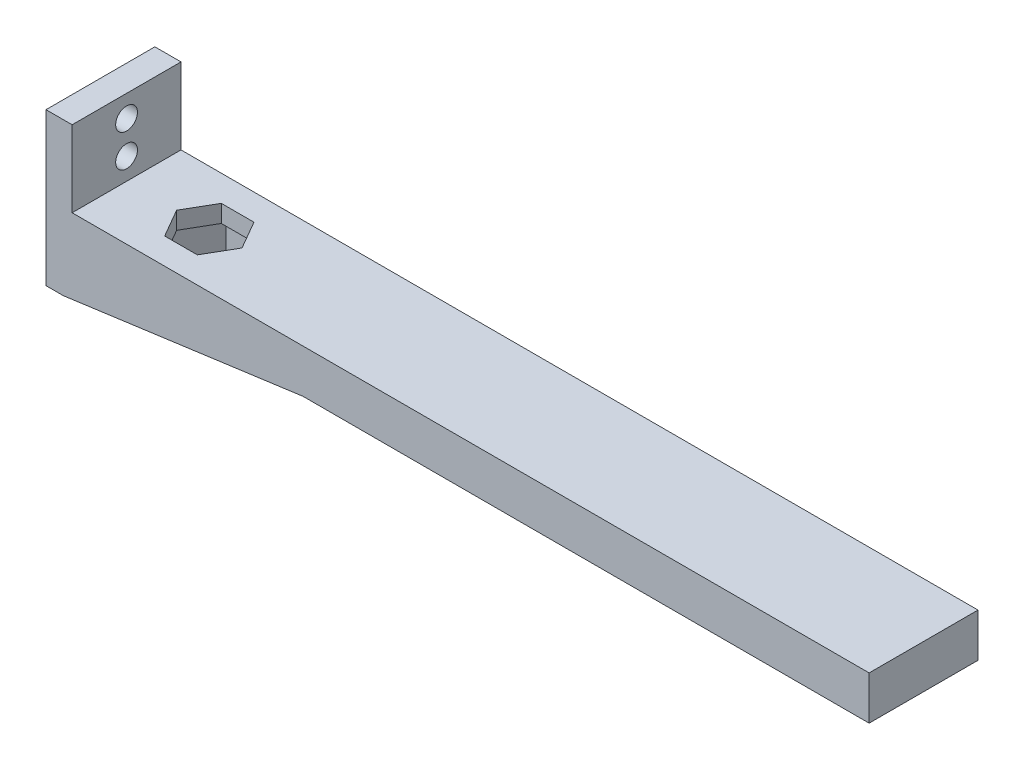
from build123d import *

# Parameters (mm, degrees)
CROQUIS3_W              = 25
CROQUIS3_H              = 35
SALIENTE_EXTRUIR2_DEPTH = 4
CROQUIS5_W              = 25
CROQUIS5_H              = 17.5
SALIENTE_EXTRUIR3_DEPTH = 2
CROQUIS7_W              = 25
CROQUIS7_H              = 10
SALIENTE_EXTRUIR5_DEPTH = 55
CROQUIS8_R              = 2.5
CORTAR_EXTRUIR1_DEPTH   = 55
SALIENTE_EXTRUIR6_DEPTH = 25
CORTAR_EXTRUIR3_DEPTH   = 4
CROQUIS11_R             = 2
CORTAR_EXTRUIR4_DEPTH   = 20
CORTAR_EXTRUIR5_DEPTH   = 45
CROQUIS13_W             = 25
CROQUIS13_H             = 10
SALIENTE_EXTRUIR7_DEPTH = 130


with BuildPart() as part:
    # Croquis3 → Saliente-Extruir2 (new body)
    with BuildSketch(Plane(origin=(0, 0, 0), x_dir=(0, 0, -1), z_dir=(1, 0, 0))):
        with Locations((4.326923077, 2.8125)):
            Rectangle(CROQUIS3_W, CROQUIS3_H)
    extrude(amount=SALIENTE_EXTRUIR2_DEPTH)

    # Croquis5 → Saliente-Extruir3 (add)
    with BuildSketch(Plane(origin=(4, 0, 0), x_dir=(0, 0, -1), z_dir=(1, 0, 0))):
        with Locations((4.326923077, 11.5625)):
            Rectangle(CROQUIS5_W, CROQUIS5_H)
    extrude(amount=SALIENTE_EXTRUIR3_DEPTH)

    # Croquis7 → Saliente-Extruir5 (add)
    with BuildSketch(Plane(origin=(4, 0, 0), x_dir=(0, 0, -1), z_dir=(1, 0, 0))):
        with Locations((4.326923077, -2.1875)):
            Rectangle(CROQUIS7_W, CROQUIS7_H)
    extrude(amount=SALIENTE_EXTRUIR5_DEPTH)

    # Croquis8 → Cortar-Extruir1 (cut)
    with BuildSketch(Plane(origin=(6, 0, 0), x_dir=(0, 0, -1), z_dir=(1, 0, 0))):
        with Locations((4.326923077, 15.3125)):
            Circle(CROQUIS8_R)
        with Locations((4.326923077, 7.8125)):
            Circle(CROQUIS8_R)
    extrude(amount=-CORTAR_EXTRUIR1_DEPTH, mode=Mode.SUBTRACT)

    # Croquis10 → Saliente-Extruir6 (add, through all)
    with BuildSketch(Plane.XY.offset(8.173076923)):
        Polygon((4, -14.6875), (59, -7.1875), (4, -7.1875), align=None)
    extrude(amount=-SALIENTE_EXTRUIR6_DEPTH)

    # Croquis9 → Cortar-Extruir3 (cut)
    with BuildSketch(Plane(origin=(0, 2.8125, 0), x_dir=(1, 0, 0), z_dir=(0, 1, 0))):
        Polygon((32.505553499, 4.326923077), (28.75277675, 10.826923077), (21.24722325, 10.826923077), (17.494446501, 4.326923077), (21.24722325, -2.173076923), (28.75277675, -2.173076923), align=None)
    extrude(amount=-CORTAR_EXTRUIR3_DEPTH, mode=Mode.SUBTRACT)

    # Croquis11 → Cortar-Extruir4 (cut)
    with BuildSketch(Plane(origin=(59, 0, 0), x_dir=(0, 0, -1), z_dir=(1, 0, 0))):
        with Locations((-1.923076923, -2.1875)):
            Circle(CROQUIS11_R)
        with Locations((10.576923077, -2.1875)):
            Circle(CROQUIS11_R)
    extrude(amount=-CORTAR_EXTRUIR4_DEPTH, mode=Mode.SUBTRACT)

    # Croquis12 → Cortar-Extruir5 (cut)
    with BuildSketch(Plane(origin=(0, -1.1875, 0), x_dir=(1, 0, 0), z_dir=(0, 1, 0))):
        Polygon((30.25388745, 13.426923077), (19.74611255, 13.426923077), (14.492225101, 4.326923077), (19.74611255, -4.773076923), (30.25388745, -4.773076923), (35.507774899, 4.326923077), align=None)
    extrude(amount=-CORTAR_EXTRUIR5_DEPTH, mode=Mode.SUBTRACT)

    # Croquis13 → Saliente-Extruir7 (add)
    with BuildSketch(Plane(origin=(59, 0, 0), x_dir=(0, 0, -1), z_dir=(1, 0, 0))):
        with Locations((4.326923077, -2.1875)):
            Rectangle(CROQUIS13_W, CROQUIS13_H)
    extrude(amount=SALIENTE_EXTRUIR7_DEPTH)


solid = part.part
